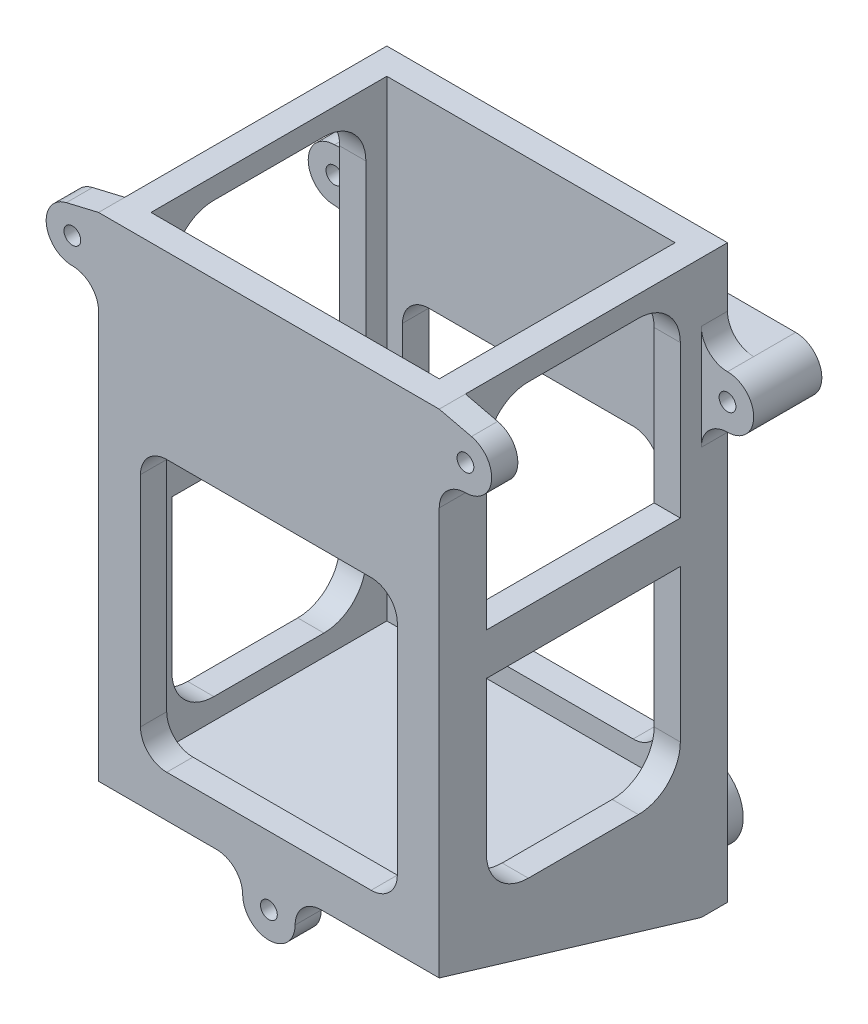
from build123d import *

# Parameters (mm, degrees)
SKETCH_1_W          = 65
SKETCH_1_H          = 55
SKETCH_1_W_2        = 55
SKETCH_1_H_2        = 45
EXTRUDE_1_DEPTH     = 90
SKETCH_2_W          = 65
SKETCH_2_H          = 55
EXTRUDE_2_DEPTH     = 4
SKETCH_3_W          = 65
SKETCH_3_H          = 15
EXTRUDE_3_DEPTH     = 5
EXTRUDE_4_DEPTH     = 5
EXTRUDE_5_DEPTH     = 5
SKETCH_6_R          = 1.6
CUT_EXTRUDE_1_DEPTH = 124.895116934
SKETCH_7_R          = 1.6
EXTRUDE_6_DEPTH     = 5
SKETCH_8_R          = 1.6
EXTRUDE_7_DEPTH     = 5
EXTRUDE_START       = 8
SKETCH_9_R          = 7.5
SKETCH_9_R_2        = 1.6
EXTRUDE_9_DEPTH     = 8
SKETCH_10_W         = 49
SKETCH_10_H         = 51.68
CUT_EXTRUDE_2_DEPTH = 130.421791055
SKETCH_12_W         = 37
SKETCH_12_H         = 37
CUT_EXTRUDE_3_DEPTH = 134.018795664
FILLET_2_R          = 8
FILLET_3_R          = 5


with BuildPart() as part:
    # 草图1 → 凸台-拉伸1 (new body)
    with BuildSketch(Plane(origin=(0, 0, 0), x_dir=(1, 0, 0), z_dir=(0, 1, 0))):
        with Locations((32.5, 27.5)):
            Rectangle(SKETCH_1_W, SKETCH_1_H)
        with Locations((32.5, 27.5)):
            Rectangle(SKETCH_1_W_2, SKETCH_1_H_2, mode=Mode.SUBTRACT)
    extrude(amount=EXTRUDE_1_DEPTH)

    # 草图2 → 凸台-拉伸2 (add)
    with BuildSketch(Plane.XZ):
        with Locations((32.5, -27.5)):
            Rectangle(SKETCH_2_W, SKETCH_2_H)
    extrude(amount=EXTRUDE_2_DEPTH)

    # 草图3 → 凸台-拉伸3 (add)
    with BuildSketch(Plane(origin=(0, 0, -55), x_dir=(-1, 0, 0), z_dir=(0, 0, -1))):
        with Locations((-32.5, -11.5)):
            Rectangle(SKETCH_3_W, SKETCH_3_H)
    extrude(amount=-EXTRUDE_3_DEPTH)

    # 草图4 → 凸台-拉伸4 (add)
    with BuildSketch(Plane(origin=(65, 0, 0), x_dir=(0, 0, -1), z_dir=(1, 0, 0))):
        Polygon((0, -4), (50, -19), (50, -4), align=None)
    extrude(amount=-EXTRUDE_4_DEPTH)

    # 草图5 → 凸台-拉伸5 (add)
    with BuildSketch(Plane.ZY):
        Polygon((-50, -19), (0, -4), (-50, -4), align=None)
    extrude(amount=-EXTRUDE_5_DEPTH)

    # 草图6 → 切除-拉伸1 (cut, through all)
    with BuildSketch(Plane(origin=(0, 0, -55), x_dir=(-1, 0, 0), z_dir=(0, 0, -1))):
        with Locations((-12.5, -11.5)):
            Circle(SKETCH_6_R)
        with Locations((-52.5, -11.5)):
            Circle(SKETCH_6_R)
    extrude(amount=-CUT_EXTRUDE_1_DEPTH, mode=Mode.SUBTRACT)

    # 草图7 → 凸台-拉伸6 (add)
    # profile 1 of 2: a face of its own
    with BuildSketch(Plane(origin=(0, 0, -55), x_dir=(-1, 0, 0), z_dir=(0, 0, -1))):
        with BuildLine():
            Line((0, 78.68), (0, 58.68))
            ThreePointArc((0, 58.68), (1.464466094, 62.215533906), (5, 63.68))
            ThreePointArc((5, 63.68), (10, 68.68), (5, 73.68))
            ThreePointArc((5, 73.68), (1.464466094, 75.144466094), (0, 78.68))
        make_face()
        with Locations((5, 68.68)):
            Circle(SKETCH_7_R, mode=Mode.SUBTRACT)
    # profile 2 of 2: a face of its own
    with BuildSketch(Plane(origin=(0, 0, -55), x_dir=(-1, 0, 0), z_dir=(0, 0, -1))):
        with BuildLine():
            Line((-65, 78.68), (-65, 58.68))
            ThreePointArc((-65, 58.68), (-66.464466094, 62.215533906), (-70, 63.68))
            ThreePointArc((-70, 63.68), (-75, 68.68), (-70, 73.68))
            ThreePointArc((-70, 73.68), (-66.464466094, 75.144466094), (-65, 78.68))
        make_face()
        with Locations(Location((-70, 68.68, 0), (0, 0, 180))):
            Circle(SKETCH_7_R, mode=Mode.SUBTRACT)
    extrude(amount=-EXTRUDE_6_DEPTH)

    # 草图8 → 凸台-拉伸7 (add)
    # profile 1 of 3: a face of its own
    with BuildSketch(Plane.XY):
        with BuildLine():
            Line((71.150434847, 88.545850354), (65, 90))
            Line((65, 90), (65, 73.68))
            ThreePointArc((65, 73.68), (66.464466094, 77.215533906), (70, 78.68))
            ThreePointArc((70, 78.68), (74.966349352, 83.100885058), (71.150434847, 88.545850354))
        make_face()
        with Locations((70, 83.68)):
            Circle(SKETCH_8_R, mode=Mode.SUBTRACT)
    # profile 2 of 3: a face of its own
    with BuildSketch(Plane.XY):
        with BuildLine():
            Line((0, 90), (0, 73.68))
            ThreePointArc((0, 73.68), (-1.464466094, 77.215533906), (-5, 78.68))
            ThreePointArc((-5, 78.68), (-9.966349352, 83.100885058), (-6.150434847, 88.545850354))
            Line((-6.150434847, 88.545850354), (0, 90))
        make_face()
        with Locations(Location((-5, 83.68, 0), (0, 0, 180))):
            Circle(SKETCH_8_R, mode=Mode.SUBTRACT)
    # profile 3 of 3: a face of its own
    with BuildSketch(Plane.XY):
        with BuildLine():
            Line((42.5, -4), (22.5, -4))
            ThreePointArc((22.5, -4), (26.035533906, -5.464466094), (27.5, -9))
            ThreePointArc((27.5, -9), (32.5, -14), (37.5, -9))
            ThreePointArc((37.5, -9), (38.964466094, -5.464466094), (42.5, -4))
        make_face()
        with Locations((32.5, -9)):
            Circle(SKETCH_8_R, mode=Mode.SUBTRACT)
    extrude(amount=-EXTRUDE_7_DEPTH)

    # 草图9 → 凸台-拉伸9 (add)
    # profile 1 of 3: a face of its own
    with BuildSketch(Plane(origin=(0, 0, -55), x_dir=(-1, 0, 0), z_dir=(0, 0, -1)).offset(EXTRUDE_START)):
        with Locations(Location((-52.5, -11.5, 0), (0, 0, 270))):
            Circle(SKETCH_9_R)
        with Locations((-52.5, -11.5)):
            Circle(SKETCH_9_R_2, mode=Mode.SUBTRACT)
    # profile 2 of 3: a face of its own
    with BuildSketch(Plane(origin=(0, 0, -55), x_dir=(-1, 0, 0), z_dir=(0, 0, -1)).offset(EXTRUDE_START)):
        with Locations(Location((-12.5, -11.5, 0), (0, 0, 270))):
            Circle(SKETCH_9_R)
        with Locations((-12.5, -11.5)):
            Circle(SKETCH_9_R_2, mode=Mode.SUBTRACT)
    # profile 3 of 3: a face of its own
    with BuildSketch(Plane(origin=(0, 0, -55), x_dir=(-1, 0, 0), z_dir=(0, 0, -1)).offset(EXTRUDE_START)):
        with BuildLine():
            Line((-70, 73.68), (5, 73.68))
            ThreePointArc((5, 73.68), (10, 68.68), (5, 63.68))
            Line((5, 63.68), (-70, 63.68))
            ThreePointArc((-70, 63.68), (-75, 68.68), (-70, 73.68))
        make_face()
        with Locations((5, 68.68)):
            Circle(SKETCH_9_R_2, mode=Mode.SUBTRACT)
        with Locations((-70, 68.68)):
            Circle(SKETCH_9_R_2, mode=Mode.SUBTRACT)
    extrude(amount=-EXTRUDE_9_DEPTH)

    # 草图10 → 切除-拉伸2 (cut, through all)
    with BuildSketch(Plane(origin=(0, 0, -55), x_dir=(-1, 0, 0), z_dir=(0, 0, -1))):
        with Locations((-32.5, 29.84)):
            Rectangle(SKETCH_10_W, SKETCH_10_H)
    extrude(amount=-CUT_EXTRUDE_2_DEPTH, mode=Mode.SUBTRACT)

    # 草图12 → 切除-拉伸3 (cut, through all)
    with BuildSketch(Plane.ZY):
        with Locations((-27.5, 67.5)):
            Rectangle(SKETCH_12_W, SKETCH_12_H)
        with Locations((-27.5, 22.5)):
            Rectangle(SKETCH_12_W, SKETCH_12_H)
    extrude(amount=-CUT_EXTRUDE_3_DEPTH, mode=Mode.SUBTRACT)

    # 圆角2
    fillet_2_edges = [part.edges().sort_by_distance(p)[0] for p in [
        (62.5, 4, -46),
        (2.5, 4, -46),
        (62.5, 4, -9),
        (2.5, 4, -9),
        (62.5, 86, -46),
        (2.5, 86, -46),
        (62.5, 86, -9),
        (2.5, 86, -9),
    ]]
    fillet(fillet_2_edges, radius=FILLET_2_R)

    # 圆角3
    fillet_3_edges = [part.edges().sort_by_distance(p)[0] for p in [
        (57, 55.68, -2.5),
        (8, 55.68, -2.5),
        (8, 4, -2.5),
        (57, 4, -2.5),
        (57, 55.68, -52.5),
        (8, 55.68, -52.5),
        (8, 4, -52.5),
        (57, 4, -52.5),
    ]]
    fillet(fillet_3_edges, radius=FILLET_3_R)


solid = part.part
